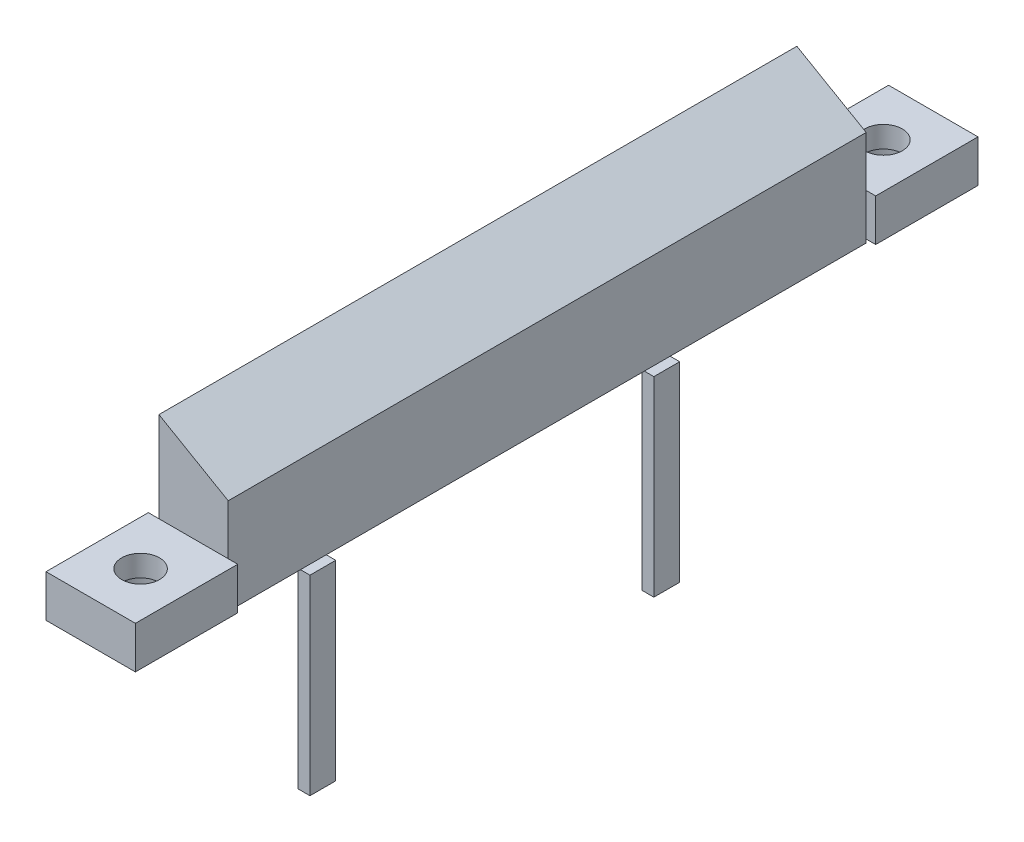
from build123d import *

# Parameters (mm, degrees)
CLAMP_START          = -20.15
CLAMP_X_COVER_DEPTH  = 37.1
EAR_START            = -26.1
SKETCH2_W            = 5.2
SKETCH2_H            = 2.45
EAR_X_COVER_26_DEPTH = 5.95
EAR_START_2          = 16.95
SKETCH3_W            = 5.2
SKETCH3_H            = 2.45
EAR_X_COVER_17_DEPTH = 5.95
CUT_EXTRUDE1_START   = 18.9
SKETCH4_R            = 1.1
CUT_EXTRUDE1_DEPTH   = 2.65
CUT_EXTRUDE2_START   = 18.99
SKETCH5_R            = 2
CUT_EXTRUDE2_DEPTH   = 1.22
BOSS_EXTRUDE4_START  = 7.69
SKETCH6_W            = 0.7
SKETCH6_H            = 1.5
BOSS_EXTRUDE4_DEPTH  = 11.11
BOSS_EXTRUDE5_START  = 7.69
SKETCH7_W            = 0.7
SKETCH7_H            = 1.5
BOSS_EXTRUDE5_DEPTH  = 11.11


with BuildPart() as part:
    # Sketch1 → Clamp +X cover (new body)
    with BuildSketch(Plane.XY.offset(CLAMP_START)):
        Polygon((13.367148847, 18.8), (17.397275866, 18.8), (17.397275866, 24.370102587), (13.367148847, 26.696897507), align=None)
    extrude(amount=CLAMP_X_COVER_DEPTH)

    # Sketch2 → Ear +X cover -26 (add)
    with BuildSketch(Plane.XY.offset(EAR_START)):
        with Locations((15.35, 20.225)):
            Rectangle(SKETCH2_W, SKETCH2_H)
    extrude(amount=EAR_X_COVER_26_DEPTH)

    # Sketch3 → Ear +X cover 17 (add)
    with BuildSketch(Plane.XY.offset(EAR_START_2)):
        with Locations((15.35, 20.225)):
            Rectangle(SKETCH3_W, SKETCH3_H)
    extrude(amount=EAR_X_COVER_17_DEPTH)

    # Sketch4 → Cut-Extrude1 (cut)
    with BuildSketch(Plane(origin=(0, 0, 0), x_dir=(1, 0, 0), z_dir=(0, 1, 0)).offset(CUT_EXTRUDE1_START)):
        with Locations(Location((15.35, 23.2, 0), (0, 0, 90))):
            Circle(SKETCH4_R)
        with Locations(Location((15.35, -20, 0), (0, 0, 90))):
            Circle(SKETCH4_R)
    extrude(amount=CUT_EXTRUDE1_DEPTH, mode=Mode.SUBTRACT)

    # Sketch5 → Cut-Extrude2 (cut)
    with BuildSketch(Plane(origin=(0, 0, 0), x_dir=(1, 0, 0), z_dir=(0, 1, 0)).offset(CUT_EXTRUDE2_START)):
        with Locations(Location((15.35, 23.2, 0), (0, 0, 270))):
            Circle(SKETCH5_R)
        with Locations(Location((15.35, -20, 0), (0, 0, 270))):
            Circle(SKETCH5_R)
    extrude(amount=CUT_EXTRUDE2_DEPTH, mode=Mode.SUBTRACT)

    # Sketch6 → Boss-Extrude4 (add)
    with BuildSketch(Plane(origin=(0, 0, 0), x_dir=(1, 0, 0), z_dir=(0, 1, 0)).offset(BOSS_EXTRUDE4_START)):
        with Locations((17.6, 8)):
            Rectangle(SKETCH6_W, SKETCH6_H)
    extrude(amount=BOSS_EXTRUDE4_DEPTH)

    # Sketch7 → Boss-Extrude5 (add)
    with BuildSketch(Plane(origin=(0, 0, 0), x_dir=(1, 0, 0), z_dir=(0, 1, 0)).offset(BOSS_EXTRUDE5_START)):
        with Locations((17.6, -12)):
            Rectangle(SKETCH7_W, SKETCH7_H)
    extrude(amount=BOSS_EXTRUDE5_DEPTH)


solid = part.part
